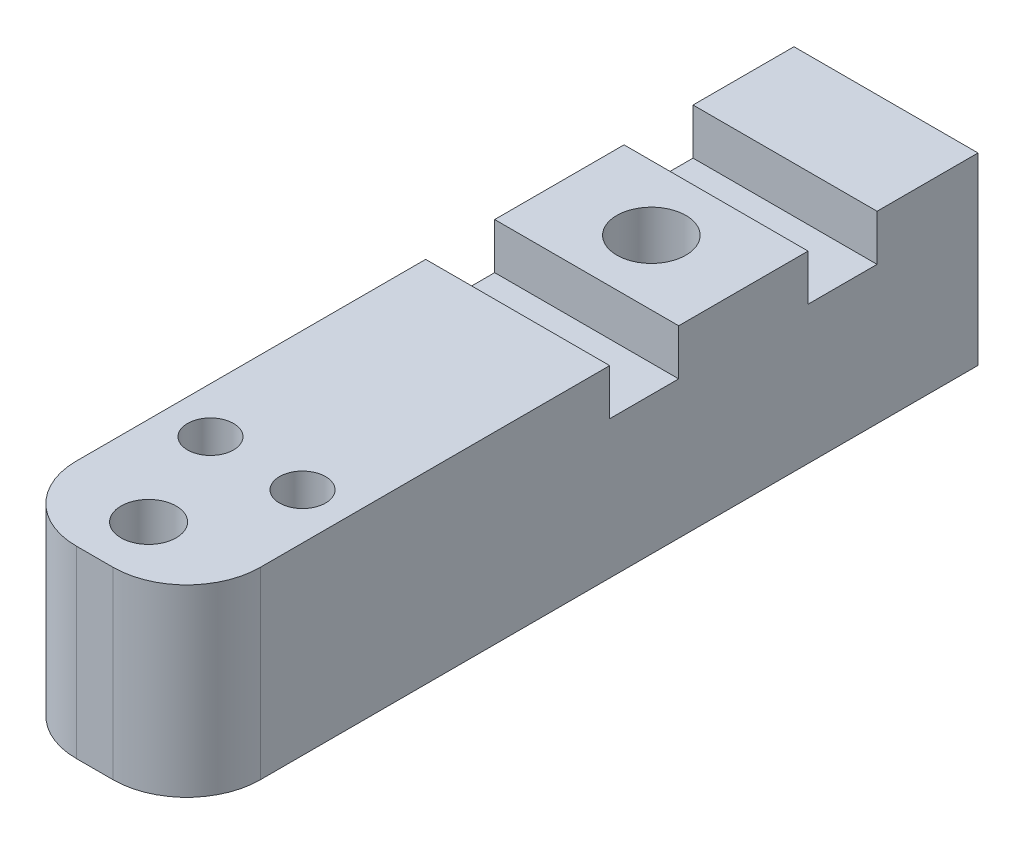
from build123d import *

# Parameters (mm, degrees)
SKETCH1_W           = 25.4
SKETCH1_H           = 25.4
BOSS_EXTRUDE1_DEPTH = 109.22
SKETCH2_R           = 2.54
CUT_EXTRUDE1_DEPTH  = 17.78
SKETCH3_R           = 4.7625
CUT_EXTRUDE2_DEPTH  = 115.975338225
SKETCH7_W           = 25.4
SKETCH7_H           = 9.525
CUT_EXTRUDE5_DEPTH  = 6.35
SKETCH9_R           = 3.175
CUT_EXTRUDE7_DEPTH  = 115.975338225
SKETCH10_R          = 3.81
CUT_EXTRUDE8_DEPTH  = 16.51
FILLET1_R           = 10.16
FILLET2_R           = 10.16


with BuildPart() as part:
    # Sketch1 → Boss-Extrude1 (new body)
    with BuildSketch(Plane.XY):
        with Locations((-12.7, 0.350344828)):
            Rectangle(SKETCH1_W, SKETCH1_H)
    extrude(amount=BOSS_EXTRUDE1_DEPTH)

    # Sketch2 → Cut-Extrude1 (cut)
    with BuildSketch(Plane(origin=(0, 0, 0), x_dir=(-1, 0, 0), z_dir=(0, 0, -1))):
        with Locations((12.7, 0)):
            Circle(SKETCH2_R)
    extrude(amount=-CUT_EXTRUDE1_DEPTH, mode=Mode.SUBTRACT)

    # Sketch3 → Cut-Extrude2 (cut, through all)
    with BuildSketch(Plane(origin=(0, 13.050344828, 0), x_dir=(1, 0, 0), z_dir=(0, 1, 0))):
        with Locations(Location((-12.7, -32.385, 0), (0, 0, 270))):
            Circle(SKETCH3_R)
    extrude(amount=-CUT_EXTRUDE2_DEPTH, mode=Mode.SUBTRACT)

    # Sketch7 → Cut-Extrude5 (cut)
    with BuildSketch(Plane(origin=(0, 13.050344828, 0), x_dir=(1, 0, 0), z_dir=(0, 1, 0))):
        with Locations((-12.7, -18.695040466)):
            Rectangle(SKETCH7_W, SKETCH7_H)
        with Locations((-12.7, -46.074959534)):
            Rectangle(SKETCH7_W, SKETCH7_H)
    extrude(amount=-CUT_EXTRUDE5_DEPTH, mode=Mode.SUBTRACT)

    # Sketch9 → Cut-Extrude7 (cut, through all)
    with BuildSketch(Plane(origin=(0, 13.050344828, 0), x_dir=(1, 0, 0), z_dir=(0, 1, 0))):
        with Locations(Location((-19.05, -86.884321607, 0), (0, 0, 270))):
            Circle(SKETCH9_R)
        with Locations(Location((-6.35, -86.884321607, 0), (0, 0, 270))):
            Circle(SKETCH9_R)
    extrude(amount=-CUT_EXTRUDE7_DEPTH, mode=Mode.SUBTRACT)

    # Sketch10 → Cut-Extrude8 (cut)
    with BuildSketch(Plane(origin=(0, 13.050344828, 0), x_dir=(1, 0, 0), z_dir=(0, 1, 0))):
        with Locations(Location((-13.13594772, -101.346, 0), (0, 0, 270))):
            Circle(SKETCH10_R)
    extrude(amount=-CUT_EXTRUDE8_DEPTH, mode=Mode.SUBTRACT)

    # Fillet1
    fillet1_edges = [part.edges().sort_by_distance(p)[0] for p in [
        (0, 0.350344828, 109.22),
    ]]
    fillet(fillet1_edges, radius=FILLET1_R)

    # Fillet2
    fillet2_edges = [part.edges().sort_by_distance(p)[0] for p in [
        (-25.4, 0.350344828, 109.22),
    ]]
    fillet(fillet2_edges, radius=FILLET2_R)


solid = part.part
